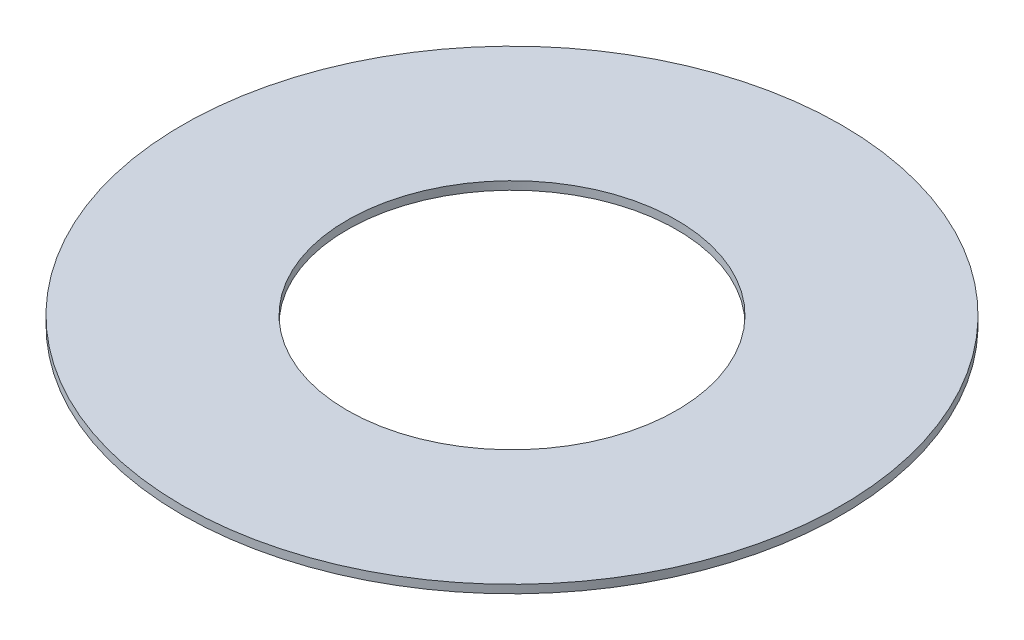
from build123d import *

# Parameters (mm, degrees)
BOSS_EXTRUDE1_DEPTH      = 0.05
BOSS_EXTRUDE1_DEPTH_BACK = 0.05
SKETCH3_R                = 4
SKETCH3_R_2              = 2


with BuildPart() as part:
    # Sketch3 → Boss-Extrude1 (new, two sides: drawn at the far end of the back side and taken through both)
    with BuildSketch(Plane(origin=(0, 0, 0), x_dir=(1, 0, 0), z_dir=(0, 1, 0)).offset(-BOSS_EXTRUDE1_DEPTH_BACK)):
        with Locations(Location((0, 0, 0), (0, 0, 270))):
            Circle(SKETCH3_R)
        with Locations(Location((0, 0, 0), (0, 0, 270))):
            Circle(SKETCH3_R_2, mode=Mode.SUBTRACT)
    extrude(amount=BOSS_EXTRUDE1_DEPTH + BOSS_EXTRUDE1_DEPTH_BACK)


solid = part.part
